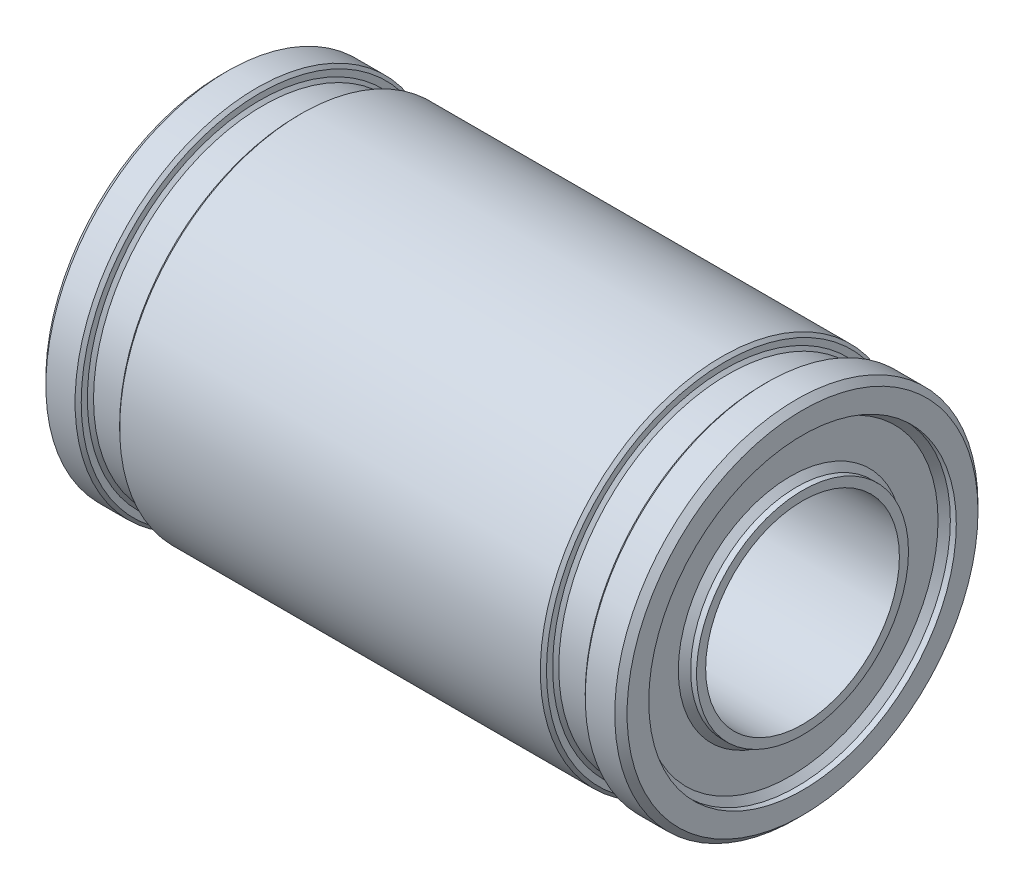
from build123d import *


with BuildPart() as part:
    # Sketch1 → Revolve1 (revolve)
    with BuildSketch(Plane.XY, mode=Mode.PRIVATE) as revolve1_sk:
        Polygon((24, 6.35), (24, 7.245999999), (23.746, 7.499999999), (22.526800001, 7.499999999), (22.399800002, 7.373000003), (22.399800002, 7.119000001), (22.272800002, 6.992000001), (20.926600003, 6.992000001), (20.7996, 7.118999997), (20.7996, 7.372999999), (20.6726, 7.499999999), (3.302000001, 7.499999999), (3.175000002, 7.373000003), (3.175000002, 7.119000001), (3.048000002, 6.992000001), (1.714500003, 6.992000001), (1.587500001, 7.118999999), (1.587500001, 7.373000001), (1.460499999, 7.499999999), (0.254, 7.499999999), (0, 7.245999999), (0, 6.35), (0.256329421, 6.35), (0.510329421, 6.096), (0.510329421, 4.629499327), (0.256329417, 4.37549933), (0, 4.37549933), (0, 3.999999997), (24, 3.999999997), (24, 4.37549933), (23.753999998, 4.37549933), (23.5, 4.629499327), (23.5, 6.096), (23.754, 6.35), align=None)
    revolve(revolve1_sk.sketch.rotate(Axis((-2e-09, 0, 0), (1, 0, 0)), 270), axis=Axis((-2e-09, 0, 0), (1, 0, 0)))


solid = part.part
